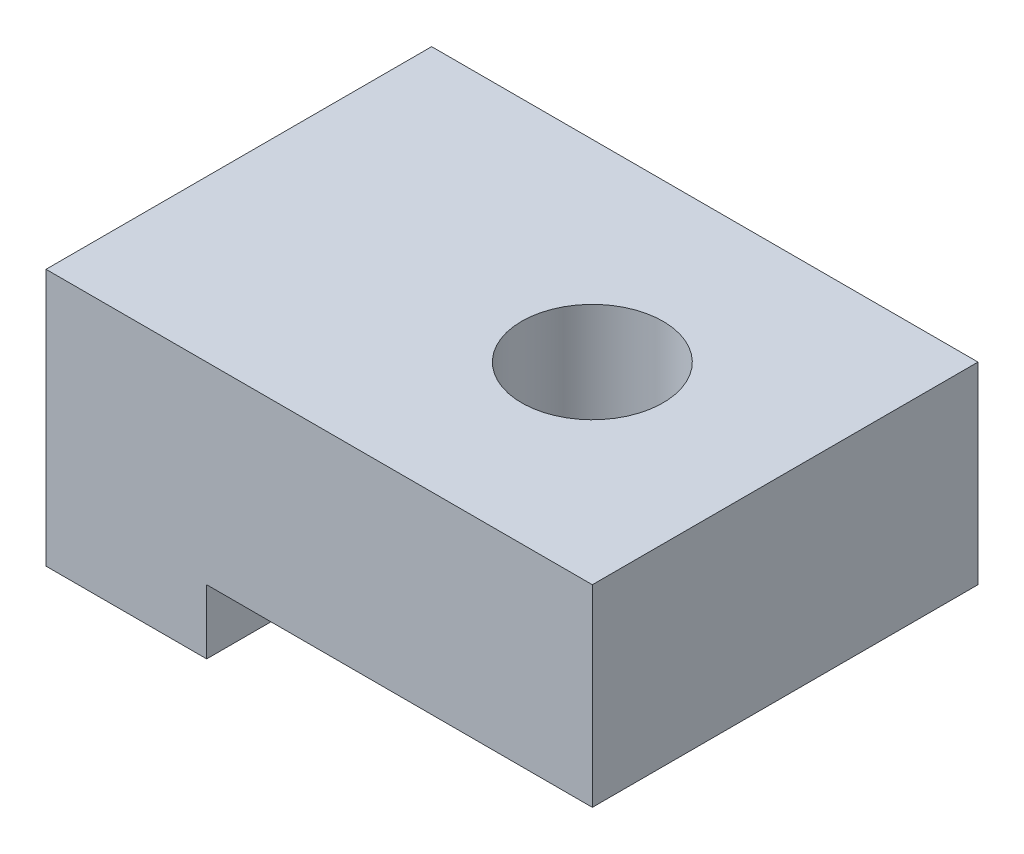
from build123d import *

# Parameters (mm, degrees)
SKETCH_1_W          = 85
SKETCH_1_H          = 40
EXTRUDE_1_DEPTH     = 30
SKETCH_2_W          = 60
SKETCH_2_H          = 10
CUT_EXTRUDE_2_DEPTH = 112.467484048
SKETCH_3_R          = 11
CUT_EXTRUDE_3_DEPTH = 99.615414617


with BuildPart() as part:
    # 草图1 → 凸台-拉伸1 (new, symmetric)
    with BuildSketch(Plane.XY):
        with Locations((-42.5, -20)):
            Rectangle(SKETCH_1_W, SKETCH_1_H)
    extrude(amount=EXTRUDE_1_DEPTH, both=True)

    # 草图2 → 切除-拉伸2 (cut, through all)
    with BuildSketch(Plane.XY.offset(30)):
        with Locations((-30, -35)):
            Rectangle(SKETCH_2_W, SKETCH_2_H)
    extrude(amount=-CUT_EXTRUDE_2_DEPTH, mode=Mode.SUBTRACT)

    # 草图3 → 切除-拉伸3 (cut, through all)
    with BuildSketch(Plane(origin=(0, 0, 0), x_dir=(1, 0, 0), z_dir=(0, 1, 0))):
        with Locations(Location((-30, 0, 0), (0, 0, 180))):
            Circle(SKETCH_3_R)
    extrude(amount=-CUT_EXTRUDE_3_DEPTH, mode=Mode.SUBTRACT)


solid = part.part
